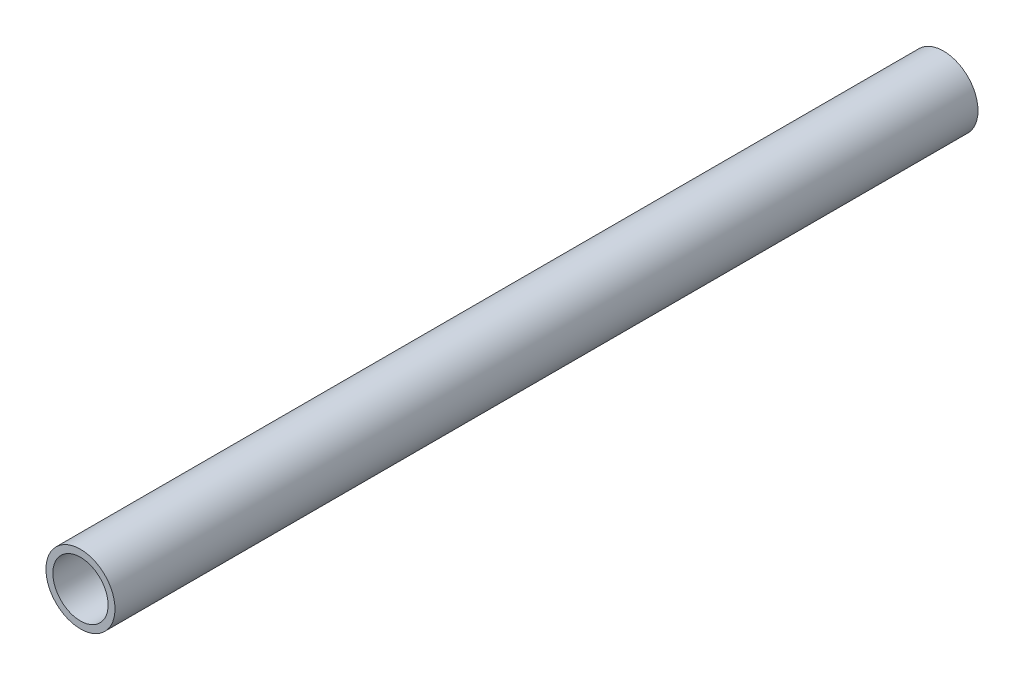
from build123d import *

# Parameters (mm, degrees)
SZKIC1_R                    = 10
SZKIC1_R_2                  = 8
DODANIE_WYCI_GNI_CIE1_DEPTH = 250


with BuildPart() as part:
    # Szkic1 → Dodanie-wyciągnięcie1 (new body)
    with BuildSketch(Plane.XY):
        Circle(SZKIC1_R)
        Circle(SZKIC1_R_2, mode=Mode.SUBTRACT)
    extrude(amount=DODANIE_WYCI_GNI_CIE1_DEPTH)


solid = part.part
